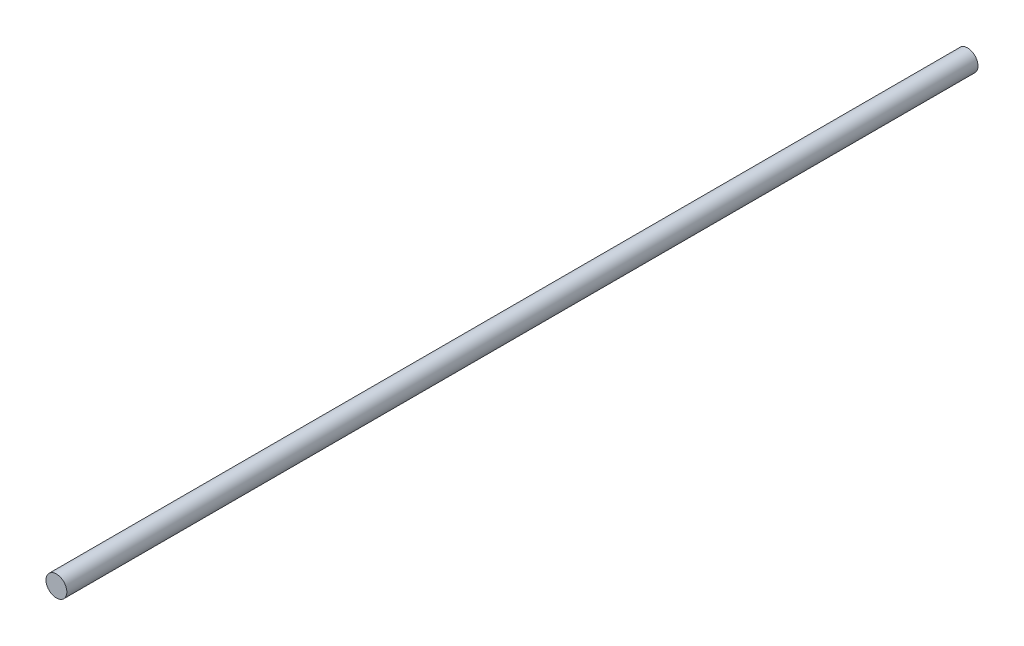
from build123d import *

# Parameters (mm, degrees)
SKETCH1_R           = 12.7
BOSS_EXTRUDE1_DEPTH = 1110


with BuildPart() as part:
    # Sketch1 → Boss-Extrude1 (new body)
    with BuildSketch(Plane.XY):
        Circle(SKETCH1_R)
    extrude(amount=BOSS_EXTRUDE1_DEPTH)


solid = part.part
